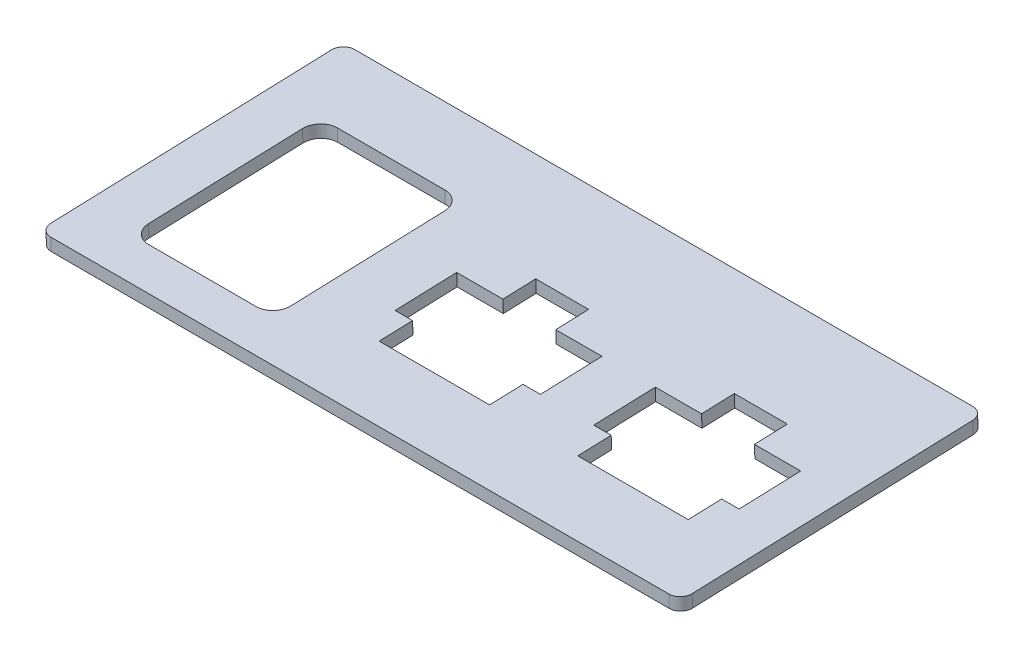
from build123d import *

# Parameters (mm, degrees)
SKETCH1_W           = 110.35
SKETCH1_H           = 52.301351528
BOSS_EXTRUDE1_DEPTH = 2.2
CUT_EXTRUDE1_REACH  = 75.143
FILLET1_R           = 2


with BuildPart() as part:
    # Sketch1 → Boss-Extrude1 (new body)
    with BuildSketch(Plane(origin=(0, -71.98718802, -2.513847999), x_dir=(1, 0, 0), z_dir=(0, 0.9993908270190958, 0.03489949670250105))):
        with Locations((0, 21.739080484)):
            Rectangle(SKETCH1_W, SKETCH1_H)
    extrude(amount=BOSS_EXTRUDE1_DEPTH)

    # Sketch2 → Cut-Extrude1 (cut, up to next)
    with BuildSketch(Plane(origin=(0, -71.98718802, -2.513847999), x_dir=(1, 0, 0), z_dir=(0, -0.9993908270190958, -0.03489949670250106)), mode=Mode.PRIVATE) as cut_extrude1_sk1:
        Polygon((-4.05, -24.262096542), (-4.05, -29.912096542), (5.05, -29.912096542), (5.05, -24.262096542), (13, -24.262096542), (13, -13.662096542), (10, -13.662096542), (10, -7.912096542), (-9, -7.912096542), (-9, -13.662096542), (-12, -13.662096542), (-12, -24.262096542), align=None)
    cut_extrude1_tool1 = extrude(cut_extrude1_sk1.sketch, amount=-CUT_EXTRUDE1_REACH, mode=Mode.PRIVATE) & part.part
    # Sketch2 → Cut-Extrude1 (cut, up to next)
    with BuildSketch(Plane(origin=(0, -71.98718802, -2.513847999), x_dir=(1, 0, 0), z_dir=(0, -0.9993908270190958, -0.03489949670250106)), mode=Mode.PRIVATE) as cut_extrude1_sk2:
        with BuildLine():
            Line((-43.425, -2.662096542), (-24.925, -2.662096542))
            ThreePointArc((-24.925, -2.662096542), (-22.803679656, -3.540776198), (-21.925, -5.662096542))
            Line((-21.925, -5.662096542), (-21.925, -32.162096542))
            ThreePointArc((-21.925, -32.162096542), (-22.803679656, -34.283416885), (-24.925, -35.162096542))
            Line((-24.925, -35.162096542), (-43.425, -35.162096542))
            ThreePointArc((-43.425, -35.162096542), (-45.546320344, -34.283416885), (-46.425, -32.162096542))
            Line((-46.425, -32.162096542), (-46.425, -5.662096542))
            ThreePointArc((-46.425, -5.662096542), (-45.546320344, -3.540776198), (-43.425, -2.662096542))
        make_face()
    cut_extrude1_tool2 = extrude(cut_extrude1_sk2.sketch, amount=-CUT_EXTRUDE1_REACH, mode=Mode.PRIVATE) & part.part
    # Sketch2 → Cut-Extrude1 (cut, up to next)
    with BuildSketch(Plane(origin=(0, -71.98718802, -2.513847999), x_dir=(1, 0, 0), z_dir=(0, -0.9993908270190958, -0.03489949670250106)), mode=Mode.PRIVATE) as cut_extrude1_sk3:
        Polygon((30.125, -24.262096542), (22.175, -24.262096542), (22.175, -13.662096542), (25.175, -13.662096542), (25.175, -7.912096542), (44.175, -7.912096542), (44.175, -13.662096542), (47.175, -13.662096542), (47.175, -24.262096542), (39.225, -24.262096542), (39.225, -29.912096542), (30.125, -29.912096542), align=None)
    cut_extrude1_tool3 = extrude(cut_extrude1_sk3.sketch, amount=-CUT_EXTRUDE1_REACH, mode=Mode.PRIVATE) & part.part
    add(cut_extrude1_tool1.solids().sort_by_distance((0.5, -71.364395, -20.348299))[0], mode=Mode.SUBTRACT)
    add(cut_extrude1_tool2.solids().sort_by_distance((-34.175, -71.327165, -21.414424))[0], mode=Mode.SUBTRACT)
    add(cut_extrude1_tool3.solids().sort_by_distance((34.675, -71.364395, -20.348299))[0], mode=Mode.SUBTRACT)

    # Fillet1
    fillet1_edges = [part.edges().sort_by_distance(p)[0] for p in [
        (-55.175, -69.21652972, -50.336041655),
        (55.175, -69.21652972, -50.336041655),
        (55.175, -71.041820566, 1.933449303),
        (-55.175, -71.041820566, 1.933449303),
    ]]
    fillet(fillet1_edges, radius=FILLET1_R)


solid = part.part
